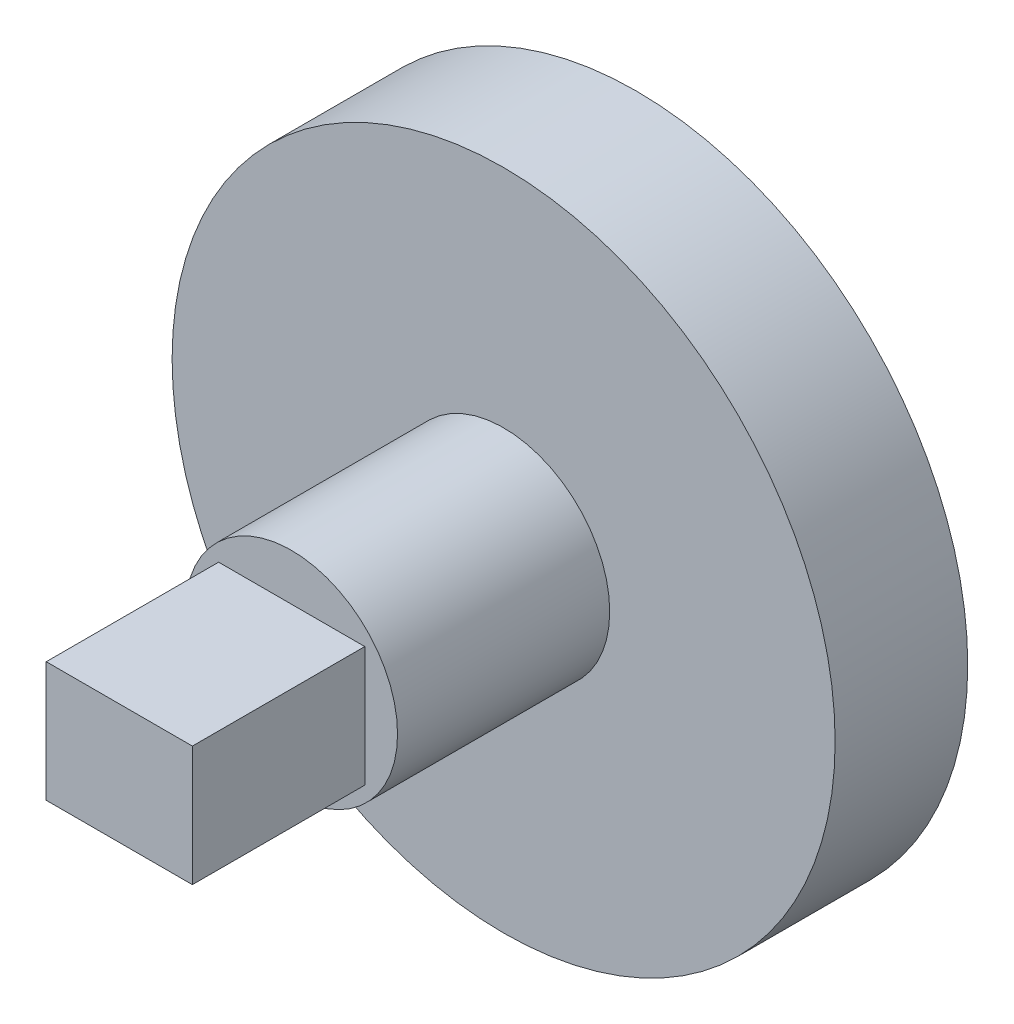
from build123d import *

# Parameters (mm, degrees)
SKETCH1_R           = 12.5
BOSS_EXTRUDE1_DEPTH = 5
SKETCH2_R           = 4
BOSS_EXTRUDE2_DEPTH = 8
SKETCH3_W           = 5.51003513
SKETCH3_H           = 4.526021733
BOSS_EXTRUDE3_DEPTH = 6.5


with BuildPart() as part:
    # Sketch1 → Boss-Extrude1 (new body)
    with BuildSketch(Plane.XY):
        Circle(SKETCH1_R)
    extrude(amount=BOSS_EXTRUDE1_DEPTH)

    # Sketch2 → Boss-Extrude2 (add)
    with BuildSketch(Plane.XY.offset(5)):
        Circle(SKETCH2_R)
    extrude(amount=BOSS_EXTRUDE2_DEPTH)

    # Sketch3 → Boss-Extrude3 (add)
    with BuildSketch(Plane.XY.offset(13)):
        with Locations((0.009307382, -0.024270034)):
            Rectangle(SKETCH3_W, SKETCH3_H)
    extrude(amount=BOSS_EXTRUDE3_DEPTH)


solid = part.part
